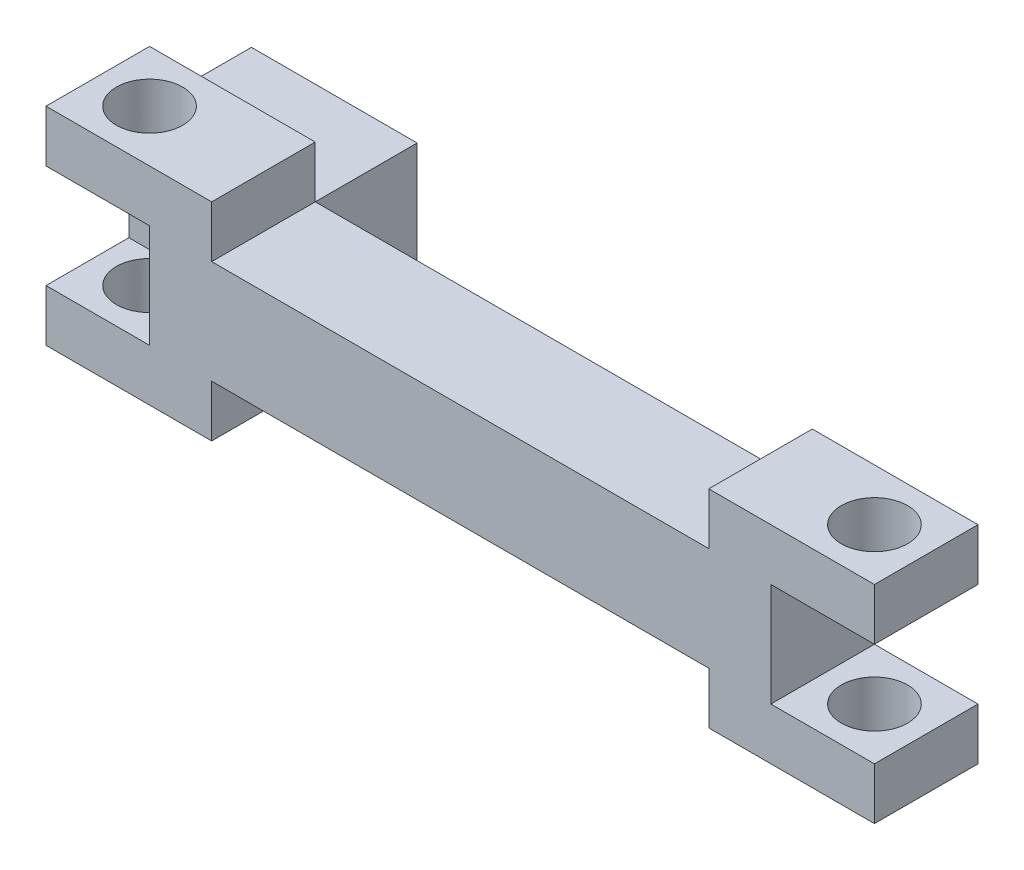
from build123d import *

# Parameters (mm, degrees)
BOSS_EXTRUDE1_DEPTH = 25
SKETCH2_R           = 8
CUT_EXTRUDE1_DEPTH  = 70.5
SKETCH3_R           = 8
CUT_EXTRUDE2_DEPTH  = 88
SKETCH4_W           = 40
SKETCH4_H           = 25
BOSS_EXTRUDE2_DEPTH = 24.6
SKETCH5_R           = 7.5
CUT_EXTRUDE4_DEPTH  = 12.5
SKETCH7_W           = 25
SKETCH7_H           = 25
CUT_EXTRUDE6_DEPTH  = 20


with BuildPart() as part:
    # Sketch1 → Boss-Extrude1 (new body)
    with BuildSketch(Plane.XY):
        Polygon((59.2, 45), (-60.8, 45), (-60.8, 57.5), (-100.8, 57.5), (-100.8, 45), (-100.8, 20), (-100.8, 7.5), (-60.8, 7.5), (-60.8, 20), (59.2, 20), (59.2, 7.5), (99.2, 7.5), (99.2, 20), (74.2, 20), (74.2, 45), (99.2, 45), (99.2, 57.5), (59.2, 57.5), align=None)
    extrude(amount=BOSS_EXTRUDE1_DEPTH)

    # Sketch2 → Cut-Extrude1 (cut)
    with BuildSketch(Plane(origin=(0, 57.5, 0), x_dir=(1, 0, 0), z_dir=(0, 1, 0))):
        with Locations(Location((-88.3, -12.5, 0), (0, 0, 180))):
            Circle(SKETCH2_R)
    extrude(amount=-CUT_EXTRUDE1_DEPTH, mode=Mode.SUBTRACT)

    # Sketch3 → Cut-Extrude2 (cut)
    with BuildSketch(Plane(origin=(0, 57.5, 0), x_dir=(1, 0, 0), z_dir=(0, 1, 0))):
        with Locations(Location((86.7, -12.5, 0), (0, 0, 270))):
            Circle(SKETCH3_R)
    extrude(amount=-CUT_EXTRUDE2_DEPTH, mode=Mode.SUBTRACT)

    # Sketch4 → Boss-Extrude2 (add)
    with BuildSketch(Plane(origin=(0, 0, 0), x_dir=(-1, 0, 0), z_dir=(0, 0, -1))):
        with Locations((80.8, 32.5)):
            Rectangle(SKETCH4_W, SKETCH4_H)
    extrude(amount=BOSS_EXTRUDE2_DEPTH)

    # Sketch5 → Cut-Extrude4 (cut)
    with BuildSketch(Plane(origin=(0, 0, -24.6), x_dir=(-1, 0, 0), z_dir=(0, 0, -1))):
        with Locations((85.8, 32.5)):
            Circle(SKETCH5_R)
    extrude(amount=-CUT_EXTRUDE4_DEPTH, mode=Mode.SUBTRACT)

    # Sketch7 → Cut-Extrude6 (cut)
    with BuildSketch(Plane.XY.offset(25)):
        with Locations((-88.3, 32.5)):
            Rectangle(SKETCH7_W, SKETCH7_H)
    extrude(amount=-CUT_EXTRUDE6_DEPTH, mode=Mode.SUBTRACT)


solid = part.part
